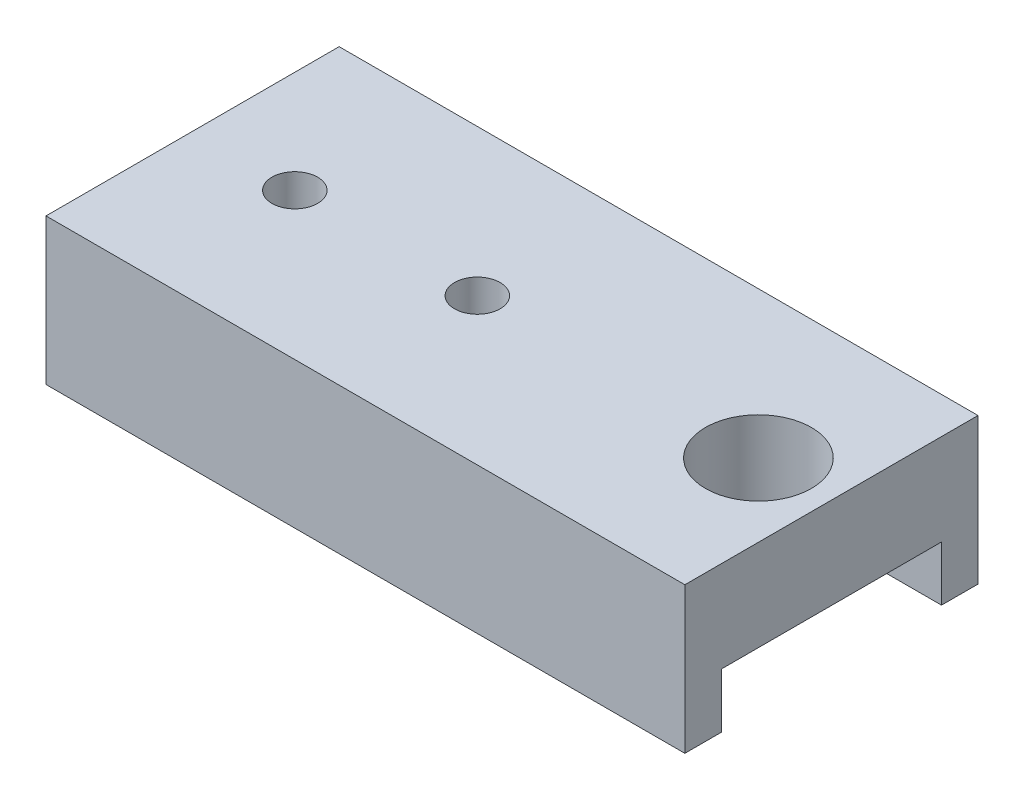
from build123d import *

# Parameters (mm, degrees)
SKETCH1_W                   = 35
SKETCH1_H                   = 12.06
BOSS_EXTRUDE1_DEPTH         = 5
M5_CLEARANCE_HOLE1_D        = 5.8
TAP_DRILL_FOR_M3X0_5_TAP1_D = 2.5
SKETCH7_W                   = 35
SKETCH7_H                   = 8
BOSS_EXTRUDE2_DEPTH         = 2


with BuildPart() as part:
    # Sketch1 → Boss-Extrude1 (new body)
    with BuildSketch(Plane(origin=(0, 0, 0), x_dir=(1, 0, 0), z_dir=(0, 1, 0))):
        Rectangle(SKETCH1_W, SKETCH1_H)
    extrude(amount=BOSS_EXTRUDE1_DEPTH)

    # M5 Clearance Hole1 (through all)
    with Locations(Plane(origin=(0, 5, 0), x_dir=(1, 0, 0), z_dir=(0, 1, 0))):
        with Locations((13.5, 0)):
            Hole(M5_CLEARANCE_HOLE1_D / 2)

    # Tap Drill for M3x0.5 Tap1 (through all)
    with Locations(Plane(origin=(0, 5, 0), x_dir=(1, 0, 0), z_dir=(0, 1, 0))):
        with Locations((-1.9, 0), (-11.9, 0)):
            Hole(TAP_DRILL_FOR_M3X0_5_TAP1_D / 2)

    # Sketch7 → Boss-Extrude2 (add)
    with BuildSketch(Plane(origin=(0, 0, -6.03), x_dir=(-1, 0, 0), z_dir=(0, 0, -1))):
        with Locations((0, 1)):
            Rectangle(SKETCH7_W, SKETCH7_H)
    extrude(amount=BOSS_EXTRUDE2_DEPTH)

    # Mirror1: part across plane


with BuildPart() as part_1:
    add(part.part)
    add(part.part.mirror(Plane.XY))


solid = part_1.part
